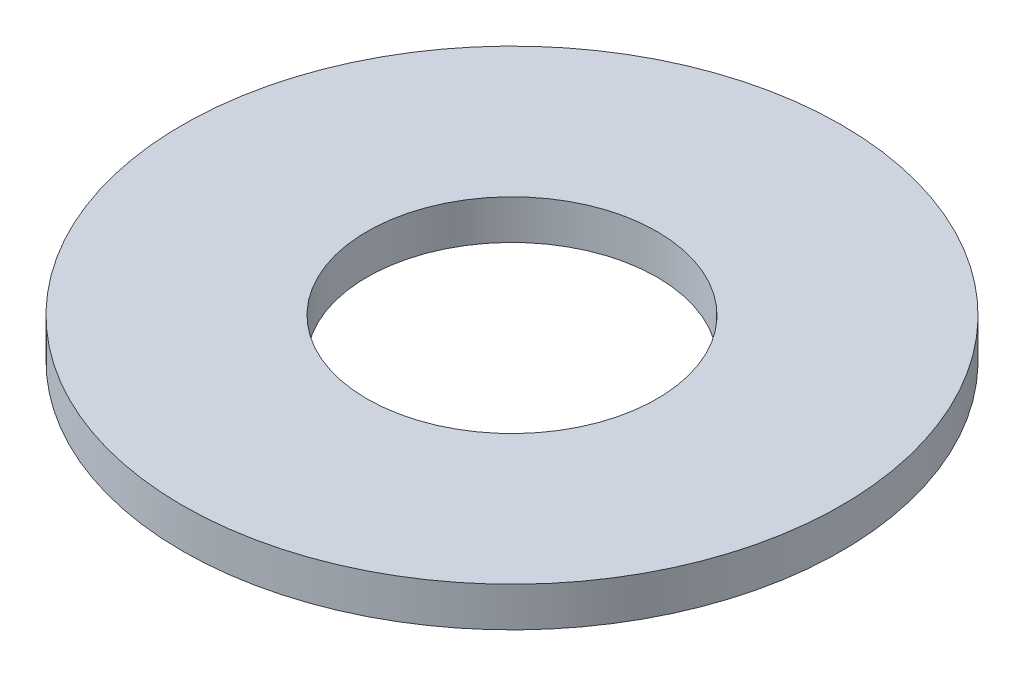
from build123d import *

# Parameters (mm, degrees)
SKETCH_1_R          = 2.5
EXTRUDE_1_DEPTH     = 0.3
SKETCH_2_R          = 1.1
CUT_EXTRUDE_1_DEPTH = 0.8


with BuildPart() as part:
    # Эскиз1 → Вытянуть1 (new body)
    with BuildSketch(Plane(origin=(0, 0, 0), x_dir=(1, 0, 0), z_dir=(0, 1, 0))):
        with Locations(Location((0, 0, 0), (0, 0, 270))):
            Circle(SKETCH_1_R)
    extrude(amount=EXTRUDE_1_DEPTH)

    # Эскиз2 → Вырез-Вытянуть1 (cut)
    with BuildSketch(Plane(origin=(0, 0.3, 0), x_dir=(-1, 0, 0), z_dir=(0, 1, 0))):
        with Locations(Location((0, 0, 0), (0, 0, 90))):
            Circle(SKETCH_2_R)
    extrude(amount=-CUT_EXTRUDE_1_DEPTH, mode=Mode.SUBTRACT)


solid = part.part
